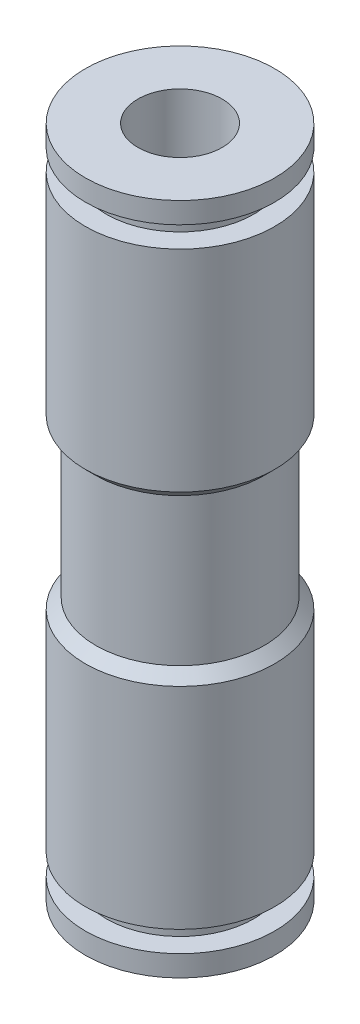
from build123d import *


with BuildPart() as part:
    # Эскиз1 → Повернуть1 (revolve)
    with BuildSketch(Plane.XY, mode=Mode.PRIVATE) as revolve_1_sk:
        Polygon((4.5, 16), (2, 16), (2, 0), (4, 0), (4, 3.5), (4.5, 4), (4.5, 14), (3.5, 14), (3.5, 15), (4.5, 15), align=None)
    revolve_1 = revolve(revolve_1_sk.sketch.rotate(Axis((0, 64.627595022, 0), (0, -1, 0)), 90), axis=Axis((0, 64.627595022, 0), (0, -1, 0)))


with BuildPart() as mirror_1_1:
    # Зеркальное отражение1: Повернуть1 across Top Plane
    add(revolve_1.mirror(Plane(origin=(0, 0, 0), x_dir=(1, 0, 0), z_dir=(0, 1, 0))))


with BuildPart() as part_1:
    add(part.part)

    # Зеркальное отражение1 united with what the copies tou: union Зеркальное отражение1_1
    add(mirror_1_1.part)


solid = part_1.part
